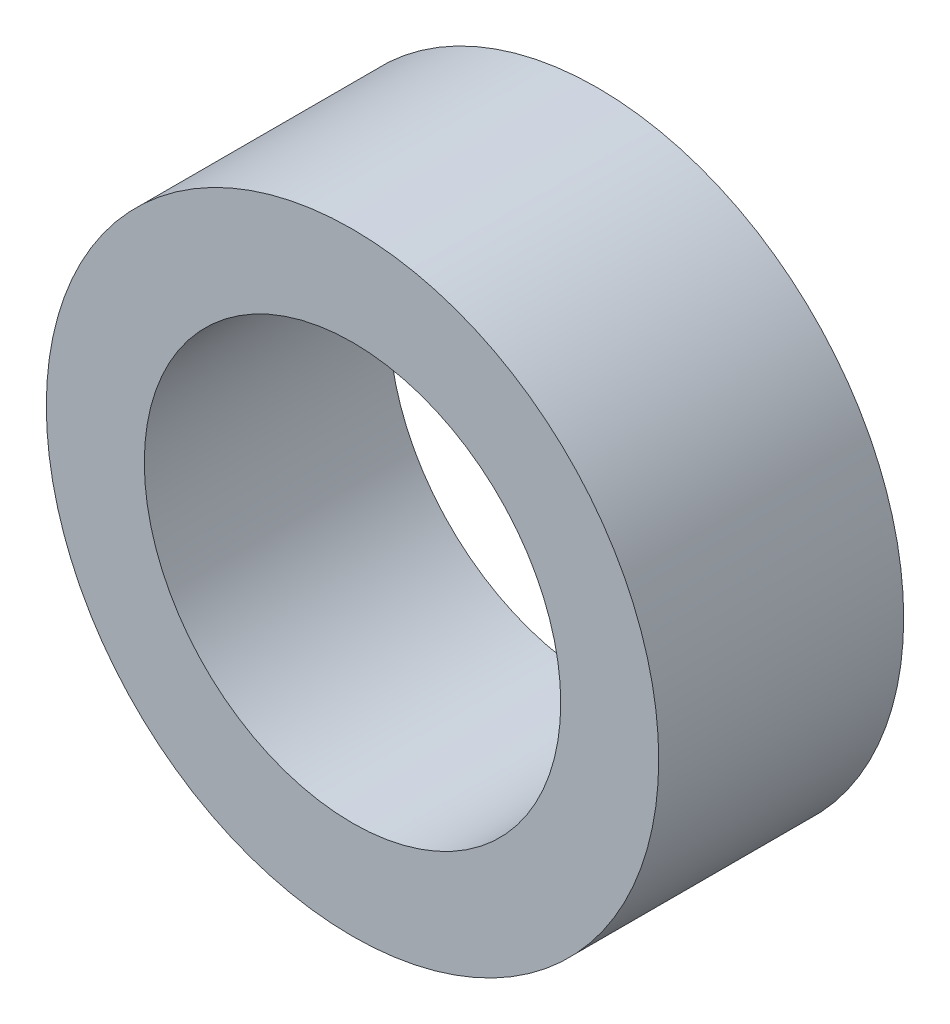
from build123d import *

# Parameters (mm, degrees)
SKETCH1_R               = 2.5
BOSS_EXTRUDE1_DEPTH     = 2
CUT_EXTRUDE1_DEPTH      = 5.062019202
CUT_EXTRUDE1_DEPTH_BACK = 5.062019202
SKETCH2_R               = 1.7


with BuildPart() as part:
    # Sketch1 → Boss-Extrude1 (new body)
    with BuildSketch(Plane(origin=(0, 0, 0), x_dir=(0, 1, 0), z_dir=(0, 0, 1))):
        with Locations(Location((0, 0, 0), (0, 0, 270))):
            Circle(SKETCH1_R)
    extrude(amount=BOSS_EXTRUDE1_DEPTH)

    # Sketch2 → Cut-Extrude1 (cut, two sides: drawn at the far end of the back side and taken through both)
    with BuildSketch(Plane.XY.offset(2).offset(-CUT_EXTRUDE1_DEPTH_BACK)):
        Circle(SKETCH2_R)
    extrude(amount=CUT_EXTRUDE1_DEPTH + CUT_EXTRUDE1_DEPTH_BACK, mode=Mode.SUBTRACT)


solid = part.part
